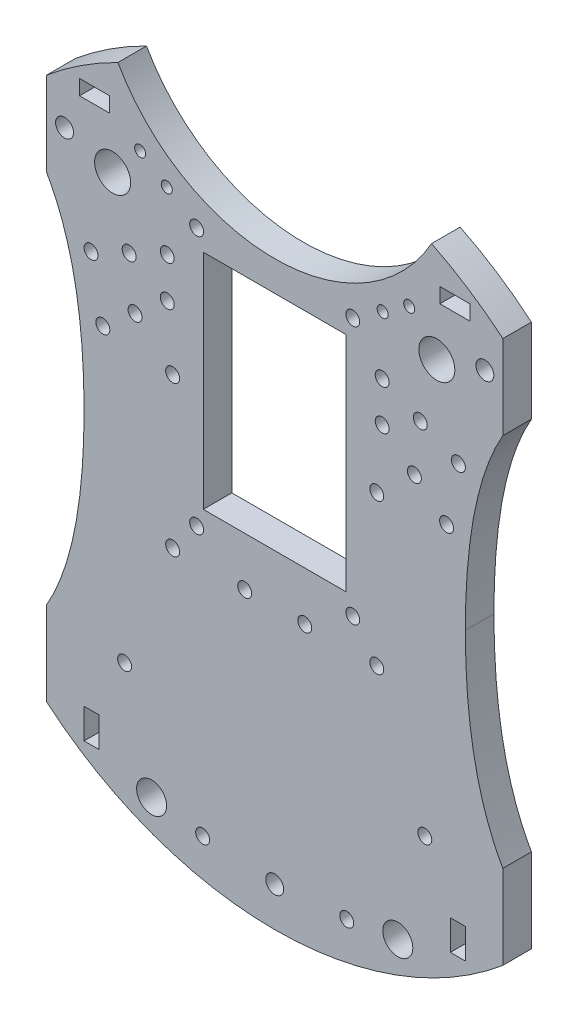
from build123d import *

# Parameters (mm, degrees)
SKETCH1_R           = 1.89865
SKETCH1_R_2         = 1.4732
BOSS_EXTRUDE3_DEPTH = 6.0452
SKETCH7_R           = 1.4732
CUT_EXTRUDE2_DEPTH  = 90.389999681
SKETCH9_R           = 1.4732
SKETCH9_W           = 30.226
SKETCH9_H           = 47.117
CUT_EXTRUDE3_DEPTH  = 14.732
SKETCH10_R          = 3.175
SKETCH10_R_2        = 3.81
SKETCH10_W          = 6.35
SKETCH10_H          = 3.175
SKETCH10_W_2        = 3.175
SKETCH10_H_2        = 6.35
CUT_EXTRUDE4_DEPTH  = 6.0452
SKETCH12_R          = 1.4732
CUT_EXTRUDE5_DEPTH  = 6.0452
SKETCH13_R          = 1.1684
CUT_EXTRUDE6_DEPTH  = 6.0452
CUT_EXTRUDE7_DEPTH  = 6.0452


with BuildPart() as part:
    # Sketch1 → Boss-Extrude3 (new body)
    with BuildSketch(Plane.XY):
        with BuildLine():
            Line((-48.26, 57.410560004), (-48.26, -57.410560004))
            ThreePointArc((-48.26, -57.410560004), (0, -75), (48.26, -57.410560004))
            Line((48.26, -57.410560004), (48.26, 57.410560004))
            ThreePointArc((48.26, 57.410560004), (41.013374249, 62.792540423), (33.172661219, 67.264957799))
            ThreePointArc((33.172661219, 67.264957799), (0, 47.904876359), (-33.172661219, 67.264957799))
            ThreePointArc((-33.172661219, 67.264957799), (-41.013374249, 62.792540423), (-48.26, 57.410560004))
        make_face()
        with Locations((0, -66.675)):
            Circle(SKETCH1_R, mode=Mode.SUBTRACT)
        with Locations((-44.45, 49.6966108)):
            Circle(SKETCH1_R, mode=Mode.SUBTRACT)
        with Locations(Location((44.45, 49.6966108, 0), (0, 0, 180))):
            Circle(SKETCH1_R, mode=Mode.SUBTRACT)
        with Locations((-21.59, -15.875)):
            Circle(SKETCH1_R_2, mode=Mode.SUBTRACT)
        with Locations((-6.35, -15.875)):
            Circle(SKETCH1_R_2, mode=Mode.SUBTRACT)
        with Locations(Location((6.35, -15.875, 0), (0, 0, 180))):
            Circle(SKETCH1_R_2, mode=Mode.SUBTRACT)
        with Locations((-15.24, -65.475)):
            Circle(SKETCH1_R_2, mode=Mode.SUBTRACT)
        with Locations(Location((15.24, -65.475, 0), (0, 0, 180))):
            Circle(SKETCH1_R_2, mode=Mode.SUBTRACT)
        with Locations(Location((21.59, -15.875, 0), (0, 0, 180))):
            Circle(SKETCH1_R_2, mode=Mode.SUBTRACT)
        with Locations((6.35, 15.875)):
            Circle(SKETCH1_R_2, mode=Mode.SUBTRACT)
        with Locations(Location((-6.35, 15.875, 0), (0, 0, 180))):
            Circle(SKETCH1_R_2, mode=Mode.SUBTRACT)
        with Locations((21.59, 15.875)):
            Circle(SKETCH1_R_2, mode=Mode.SUBTRACT)
        with Locations(Location((-21.59, 15.875, 0), (0, 0, 180))):
            Circle(SKETCH1_R_2, mode=Mode.SUBTRACT)
    extrude(amount=BOSS_EXTRUDE3_DEPTH)

    # Sketch7 → Cut-Extrude2 (cut, through all)
    with BuildSketch(Plane.XY.offset(6.0452)):
        with Locations(Location((-31.75, -41.98, 0), (0, 0, 180))):
            Circle(SKETCH7_R)
        with Locations((31.75, -41.98)):
            Circle(SKETCH7_R)
    extrude(amount=-CUT_EXTRUDE2_DEPTH, mode=Mode.SUBTRACT)

    # Sketch9 → Cut-Extrude3 (cut)
    with BuildSketch(Plane.XY.offset(6.0452)):
        with Locations((-16.51, 45.301376359)):
            Circle(SKETCH9_R)
        with Locations((16.51, 45.301376359)):
            Circle(SKETCH9_R)
        with Locations((-16.51, -9.308623641)):
            Circle(SKETCH9_R)
        with Locations((16.51, -9.308623641)):
            Circle(SKETCH9_R)
        with Locations((0, 17.996376359)):
            Rectangle(SKETCH9_W, SKETCH9_H)
    extrude(amount=-CUT_EXTRUDE3_DEPTH, mode=Mode.SUBTRACT)

    # Sketch10 → Cut-Extrude4 (cut)
    with BuildSketch(Plane.XY.offset(6.0452)):
        with Locations((-26.035, -63.760560004)):
            Circle(SKETCH10_R)
        with Locations((26.035, -63.760560004)):
            Circle(SKETCH10_R)
        with Locations((-34.29, 46.584848501)):
            Circle(SKETCH10_R_2)
        with Locations((34.29, 46.584848501)):
            Circle(SKETCH10_R_2)
        with Locations((-38.1, 58.699876359)):
            Rectangle(SKETCH10_W, SKETCH10_H)
        with Locations((38.1, 58.699876359)):
            Rectangle(SKETCH10_W, SKETCH10_H)
        with Locations((-38.735, -57.410560004)):
            Rectangle(SKETCH10_W_2, SKETCH10_H_2)
        with Locations((38.735, -57.410560004)):
            Rectangle(SKETCH10_W_2, SKETCH10_H_2)
    extrude(amount=-CUT_EXTRUDE4_DEPTH, mode=Mode.SUBTRACT)

    # Sketch12 → Cut-Extrude5 (cut)
    with BuildSketch(Plane.XY.offset(6.0452)):
        with Locations((22.733, 37.304304366)):
            Circle(SKETCH12_R)
        with Locations((30.790076227, 33.547228019)):
            Circle(SKETCH12_R)
        with Locations((38.847152454, 29.790151672)):
            Circle(SKETCH12_R)
        with Locations((22.733, 28.829624443)):
            Circle(SKETCH12_R)
        with Locations((29.543135099, 23.115242593)):
            Circle(SKETCH12_R)
        with Locations((36.353270199, 17.400860743)):
            Circle(SKETCH12_R)
        with Locations((43.163405298, 11.686478893)):
            Circle(SKETCH12_R)
        with Locations((-43.163405298, 11.686478893)):
            Circle(SKETCH12_R)
        with Locations((-36.353270199, 17.400860743)):
            Circle(SKETCH12_R)
        with Locations((-29.543135099, 23.115242593)):
            Circle(SKETCH12_R)
        with Locations((-22.733, 28.829624443)):
            Circle(SKETCH12_R)
        with Locations((-38.847152454, 29.790151672)):
            Circle(SKETCH12_R)
        with Locations((-30.790076227, 33.547228019)):
            Circle(SKETCH12_R)
        with Locations((-22.733, 37.304304366)):
            Circle(SKETCH12_R)
    extrude(amount=-CUT_EXTRUDE5_DEPTH, mode=Mode.SUBTRACT)

    # Sketch13 → Cut-Extrude6 (cut)
    with BuildSketch(Plane.XY.offset(6.0452)):
        with Locations((22.832493661, 49.627795037)):
            Circle(SKETCH13_R)
        with Locations((-22.832493661, 49.627795037)):
            Circle(SKETCH13_R)
        with Locations((-28.455572264, 53.419074276)):
            Circle(SKETCH13_R)
        with Locations((28.455572264, 53.419074276)):
            Circle(SKETCH13_R)
    extrude(amount=-CUT_EXTRUDE6_DEPTH, mode=Mode.SUBTRACT)

    # Sketch14 → Cut-Extrude7 (cut)
    with BuildSketch(Plane.XY.offset(6.0452)):
        with BuildLine():
            Line((-48.26, 39.630560004), (-48.26, -39.630560004))
            add(Edge.make_bspline(
                [(-48.26, -39.630560004), (-40.3225, -25.882406719), (-40.3225, 0)],
                knots=[0, 0, 0, 1, 1, 1], degree=2))
            add(Edge.make_bspline(
                [(-48.26, 39.630560004), (-40.3225, 25.882406719), (-40.3225, 0)],
                knots=[0, 0, 0, 1, 1, 1], degree=2))
        make_face()
        with BuildLine():
            Line((48.26, 39.630560004), (48.26, -39.630560004))
            add(Edge.make_bspline(
                [(48.26, -39.630560004), (40.3225, -25.882406719), (40.3225, 0)],
                knots=[0, 0, 0, 1, 1, 1], degree=2))
            add(Edge.make_bspline(
                [(48.26, 39.630560004), (40.3225, 25.882406719), (40.3225, 0)],
                knots=[0, 0, 0, 1, 1, 1], degree=2))
        make_face()
    extrude(amount=-CUT_EXTRUDE7_DEPTH, mode=Mode.SUBTRACT)


solid = part.part
